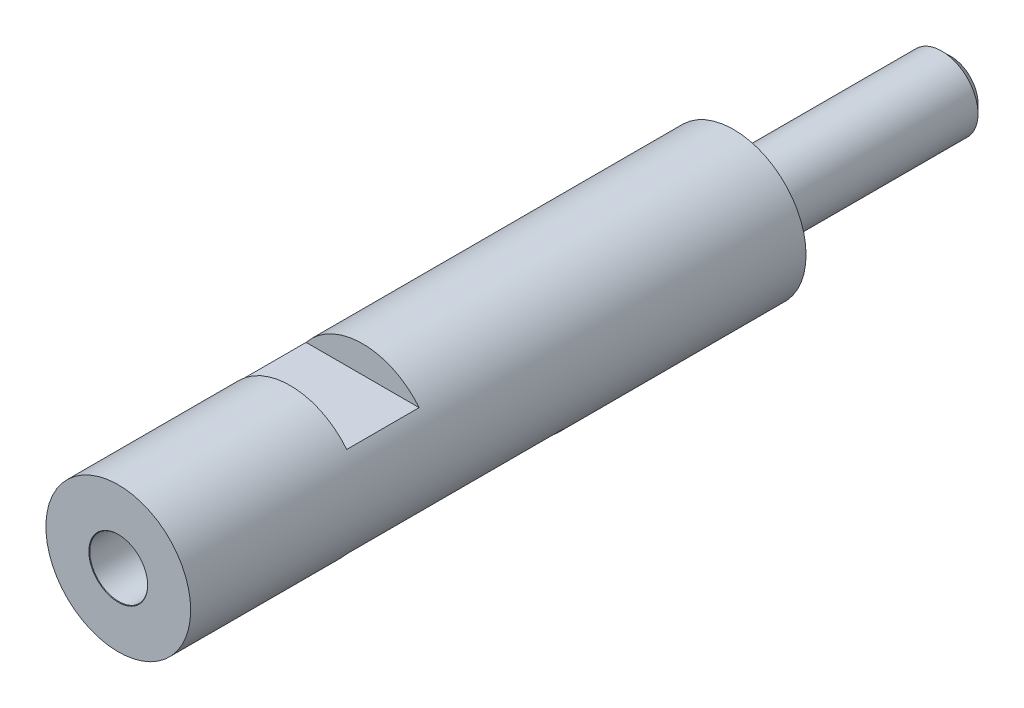
from build123d import *

# Parameters (mm, degrees)
SKETCH1_R                            = 2
BOSS_EXTRUDE3_DEPTH                  = 12
SKETCH3_R                            = 4
BOSS_EXTRUDE4_DEPTH                  = 34
SKETCH4_W                            = 4
SKETCH4_H                            = 1.5
SKETCH4_W_2                          = 12
CUT_EXTRUDE1_DEPTH                   = 17
F_3_2_3_2_DIAMETER_HOLE1_D           = 3.2
F_3_2_3_2_DIAMETER_HOLE1_DEPTH       = 14
F_3_2_3_2_DIAMETER_HOLE1_CSINK_D     = 3.25
F_3_2_3_2_DIAMETER_HOLE1_CSINK_ANGLE = 90
F_3_2_3_2_DIAMETER_HOLE1_TIP         = 0.96137699
CHAMFER1_SIZE                        = 0.5


with BuildPart() as part:
    # Sketch1 → Boss-Extrude3 (new body)
    with BuildSketch(Plane.XY):
        Circle(SKETCH1_R)
    extrude(amount=-BOSS_EXTRUDE3_DEPTH)

    # Sketch3 → Boss-Extrude4 (add)
    with BuildSketch(Plane.XY):
        Circle(SKETCH3_R)
    extrude(amount=BOSS_EXTRUDE4_DEPTH)

    # Sketch4 → Cut-Extrude1 (cut, symmetric)
    with BuildSketch(Plane(origin=(0, 0, 0), x_dir=(0, 0, -1), z_dir=(1, 0, 0))):
        with Locations((-22.5, 3.25)):
            Rectangle(SKETCH4_W, SKETCH4_H)
        with Locations((-18.5, -3.25)):
            Rectangle(SKETCH4_W_2, SKETCH4_H)
    extrude(amount=CUT_EXTRUDE1_DEPTH, both=True, mode=Mode.SUBTRACT)

    # Ø3.2 (3.2) Diameter Hole1
    with Locations(Plane.XY.offset(34)):
        with Locations((0, 0)):
            CounterSinkHole(F_3_2_3_2_DIAMETER_HOLE1_D / 2, F_3_2_3_2_DIAMETER_HOLE1_CSINK_D / 2, depth=F_3_2_3_2_DIAMETER_HOLE1_DEPTH, counter_sink_angle=F_3_2_3_2_DIAMETER_HOLE1_CSINK_ANGLE)
            with Locations((0, 0, -(F_3_2_3_2_DIAMETER_HOLE1_DEPTH + F_3_2_3_2_DIAMETER_HOLE1_TIP / 2))):  # 118° drill point
                Cone(0, F_3_2_3_2_DIAMETER_HOLE1_D / 2, F_3_2_3_2_DIAMETER_HOLE1_TIP, mode=Mode.SUBTRACT)

    # Chamfer1
    chamfer1_edges = [part.edges().sort_by_distance(p)[0] for p in [
        (-2, 0, -12),
    ]]
    chamfer(chamfer1_edges, length=CHAMFER1_SIZE)


solid = part.part
